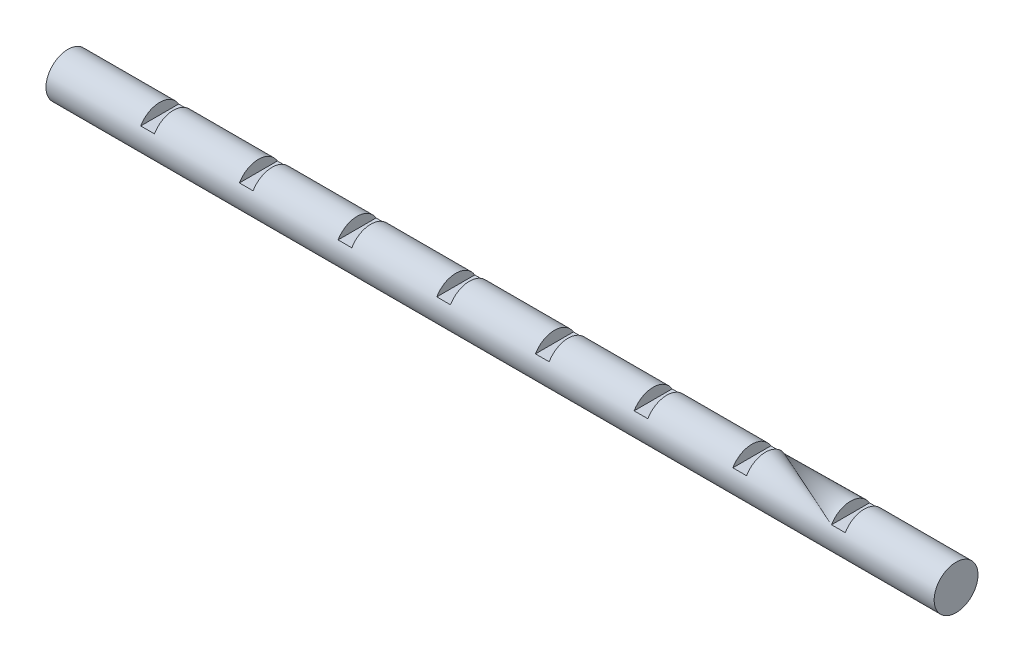
from build123d import *

# Parameters (mm, degrees)
SKETCH2_R           = 4
BOSS_EXTRUDE1_DEPTH = 81
CUT_EXTRUDE1_START  = 2
SKETCH3_W           = 2.5
SKETCH3_H           = 8
CUT_EXTRUDE1_DEPTH  = 10


with BuildPart() as part:
    # Sketch2 → Boss-Extrude1 (new, symmetric)
    with BuildSketch(Plane(origin=(0, 0, 0), x_dir=(0, 0, -1), z_dir=(1, 0, 0))):
        Circle(SKETCH2_R)
    extrude(amount=BOSS_EXTRUDE1_DEPTH, both=True)

    # Sketch3 → Cut-Extrude1 (cut)
    with BuildSketch(Plane(origin=(0, 0, 0), x_dir=(1, 0, 0), z_dir=(0, 1, 0)).offset(CUT_EXTRUDE1_START)):
        with Locations((-63, 0)):
            Rectangle(SKETCH3_W, SKETCH3_H)
        with Locations((-45, 0)):
            Rectangle(SKETCH3_W, SKETCH3_H)
        with Locations((-27, 0)):
            Rectangle(SKETCH3_W, SKETCH3_H)
        with Locations((-9, 0)):
            Rectangle(SKETCH3_W, SKETCH3_H)
        with Locations((9, 0)):
            Rectangle(SKETCH3_W, SKETCH3_H)
        with Locations((27, 0)):
            Rectangle(SKETCH3_W, SKETCH3_H)
        with Locations((45, 0)):
            Rectangle(SKETCH3_W, SKETCH3_H)
        with Locations((63, 0)):
            Rectangle(SKETCH3_W, SKETCH3_H)
    extrude(amount=CUT_EXTRUDE1_DEPTH, mode=Mode.SUBTRACT)


solid = part.part
